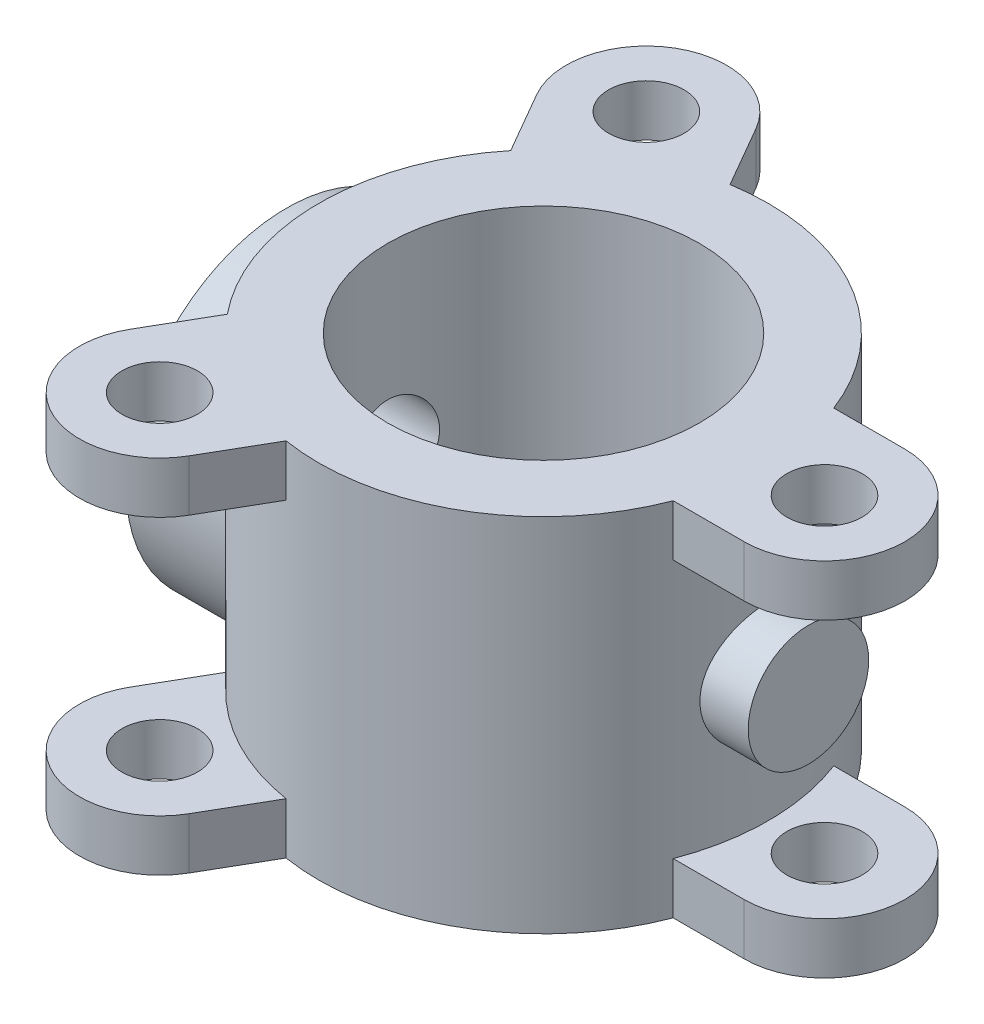
from build123d import *
from build123d.topology import SkipClean

# Parameters (mm, degrees)
SKETCH1_R                = 97
SKETCH1_R_2              = 23.5
BOSS_EXTRUDE1_DEPTH      = 112.5
SKETCH2_R                = 250
SKETCH2_R_2              = 140
CUT_EXTRUDE8_DEPTH       = 80.5
BOSS_EXTRUDE2_START      = -160
SKETCH4_R                = 100
BOSS_EXTRUDE2_DEPTH      = 62.02041
SKETCH5_R                = 10.15
CUT_EXTRUDE9_DEPTH       = 15
SKETCH6_R                = 50
CUT_EXTRUDE10_DEPTH      = 25
BOSS_EXTRUDE3_REACH      = 775.894
BOSS_EXTRUDE3_END_RADIUS = 140
BOSS_EXTRUDE3_START      = -325
SKETCH7_R                = 37.5
SKETCH8_R                = 28.1
CUT_EXTRUDE11_DEPTH      = 310


with BuildPart() as part:
    # Sketch1 → Boss-Extrude1 (new, symmetric)
    with BuildSketch(Plane(origin=(0, 0, 0), x_dir=(1, 0, 0), z_dir=(0, 1, 0))):
        with BuildLine():
            Line((130.766968306, 50), (175, 50))
            ThreePointArc((175, 50), (225, 0), (175, -50))
            Line((175, -50), (130.766968306, -50))
            ThreePointArc((130.766968306, -50), (70, -121.24355653), (-22.082213964, -138.247516529))
            Line((-22.082213964, -138.247516529), (-44.198729811, -176.554445662))
            ThreePointArc((-44.198729811, -176.554445662), (-112.5, -194.855715851), (-130.801270189, -126.554445662))
            Line((-130.801270189, -126.554445662), (-108.684754342, -88.247516529))
            ThreePointArc((-108.684754342, -88.247516529), (-140, 0), (-108.684754342, 88.247516529))
            Line((-108.684754342, 88.247516529), (-130.801270189, 126.554445662))
            ThreePointArc((-130.801270189, 126.554445662), (-112.5, 194.855715851), (-44.198729811, 176.554445662))
            Line((-44.198729811, 176.554445662), (-22.082213964, 138.247516529))
            ThreePointArc((-22.082213964, 138.247516529), (70, 121.24355653), (130.766968306, 50))
        make_face()
        with Locations(Location((0, 0, 0), (0, 0, 270))):
            Circle(SKETCH1_R, mode=Mode.SUBTRACT)
        with Locations(Location((175, 0, 0), (0, 0, 270))):
            Circle(SKETCH1_R_2, mode=Mode.SUBTRACT)
        with Locations(Location((-87.5, -151.554445662, 0), (0, 0, 270))):
            Circle(SKETCH1_R_2, mode=Mode.SUBTRACT)
        with Locations(Location((-87.5, 151.554445662, 0), (0, 0, 270))):
            Circle(SKETCH1_R_2, mode=Mode.SUBTRACT)
    extrude(amount=BOSS_EXTRUDE1_DEPTH, both=True)

    # Sketch2 → Cut-Extrude8 (cut, symmetric)
    with SkipClean():  # the faces are left unmerged after this step: merging them gives an invalid solid
        with BuildSketch(Plane(origin=(0, 0, 0), x_dir=(1, 0, 0), z_dir=(0, 1, 0))):
            Circle(SKETCH2_R)
            with Locations(Location((0, 0, 0), (0, 0, 99.075167572))):
                Circle(SKETCH2_R_2, mode=Mode.SUBTRACT)
        extrude(amount=CUT_EXTRUDE8_DEPTH, both=True, mode=Mode.SUBTRACT)

    # Sketch4 → Boss-Extrude2 (add)
    with SkipClean():  # the faces are left unmerged after this step: merging them gives an invalid solid
        with BuildSketch(Plane(origin=(0, 0, 0), x_dir=(0, 0, -1), z_dir=(1, 0, 0)).offset(BOSS_EXTRUDE2_START)):
            with Locations(Location((0, 0, 0), (0, 0, 180))):
                Circle(SKETCH4_R)
        extrude(amount=BOSS_EXTRUDE2_DEPTH)

    # Sketch5 → Cut-Extrude9 (cut)
    with SkipClean():  # the faces are left unmerged after this step: merging them gives an invalid solid
        with BuildSketch(Plane.ZY.offset(160)):
            with Locations((0, 75)):
                Circle(SKETCH5_R)
            with Locations((64.951905284, -37.5)):
                Circle(SKETCH5_R)
            with Locations((-64.951905284, -37.5)):
                Circle(SKETCH5_R)
        extrude(amount=-CUT_EXTRUDE9_DEPTH, mode=Mode.SUBTRACT)

    # Sketch6 → Cut-Extrude10 (cut)
    with SkipClean():  # the faces are left unmerged after this step: merging them gives an invalid solid
        with BuildSketch(Plane.ZY.offset(160)):
            Circle(SKETCH6_R)
        extrude(amount=-CUT_EXTRUDE10_DEPTH, mode=Mode.SUBTRACT)

    # Boss-Extrude3: up to this cylinder (the profile starts outside it)
    with SkipClean():  # the faces are left unmerged after this step: merging them gives an invalid solid
        boss_extrude3_end = Plane(origin=(0, 0, 0), z_dir=(0, -1, 0)) * Cylinder(BOSS_EXTRUDE3_END_RADIUS, 1832.788, mode=Mode.PRIVATE)
        # Sketch7 → Boss-Extrude3 (add, up to the surface)
        with BuildSketch(Plane.ZY.offset(160).offset(BOSS_EXTRUDE3_START), mode=Mode.PRIVATE) as boss_extrude3_sk1:
            with Locations(Location((0, 0, 0), (0, 0, 180))):
                Circle(SKETCH7_R)
        boss_extrude3_tool1 = extrude(boss_extrude3_sk1.sketch, amount=BOSS_EXTRUDE3_REACH, mode=Mode.PRIVATE) - boss_extrude3_end
        add(boss_extrude3_tool1.solids().sort_by_distance((165, 0, 0))[0])

    # Sketch8 → Cut-Extrude11 (cut)
    with SkipClean():  # the faces are left unmerged after this step: merging them gives an invalid solid
        with BuildSketch(Plane.ZY.offset(160)):
            Circle(SKETCH8_R)
        extrude(amount=-CUT_EXTRUDE11_DEPTH, mode=Mode.SUBTRACT)


solid = part.part
